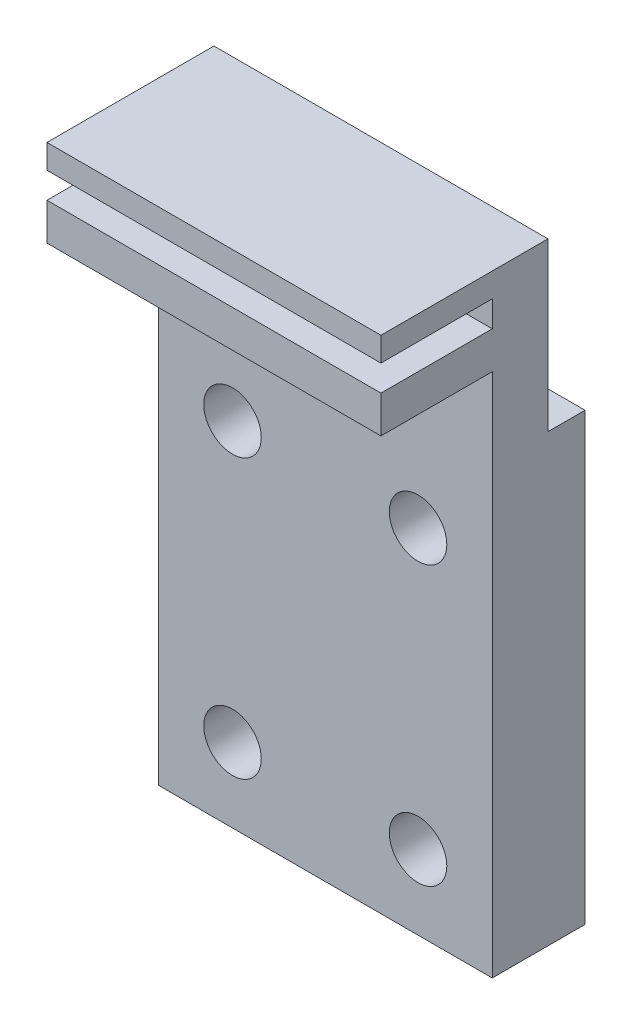
from build123d import *

# Parameters (mm, degrees)
SKIZZE1_W                       = 18
SKIZZE1_H                       = 33
SKIZZE1_R                       = 1.55
AUFSATZ_LINEAR_AUSTRAGEN3_DEPTH = 5
SKIZZE1_4_W                     = 18
SKIZZE1_4_H                     = 2
SKIZZE1_4_H_2                   = 1.3
AUFSATZ_LINEAR_AUSTRAGEN4_DEPTH = 6
SKIZZE2_W                       = 2
SKIZZE2_H                       = 9
SCHNITT_LINEAR_AUSTRAGEN1_DEPTH = 29.674901918


with BuildPart() as part:
    # Skizze1 → Aufsatz-Linear austragen3 (new body)
    with BuildSketch(Plane.XY):
        with Locations((0, 5)):
            Rectangle(SKIZZE1_W, SKIZZE1_H)
        with Locations((5, 7.5)):
            Circle(SKIZZE1_R, mode=Mode.SUBTRACT)
        with Locations((-5, -7.5)):
            Circle(SKIZZE1_R, mode=Mode.SUBTRACT)
        with Locations((5, -7.5)):
            Circle(SKIZZE1_R, mode=Mode.SUBTRACT)
        with Locations((-5, 7.5)):
            Circle(SKIZZE1_R, mode=Mode.SUBTRACT)
    extrude(amount=-AUFSATZ_LINEAR_AUSTRAGEN3_DEPTH)

    # Skizze1<4> → Aufsatz-Linear austragen4 (add)
    with BuildSketch(Plane.XY):
        with Locations((0, 17.8)):
            Rectangle(SKIZZE1_4_W, SKIZZE1_4_H)
        with Locations((0, 20.85)):
            Rectangle(SKIZZE1_4_W, SKIZZE1_4_H_2)
    extrude(amount=AUFSATZ_LINEAR_AUSTRAGEN4_DEPTH)

    # Skizze2 → Schnitt-Linear austragen1 (cut, through all)
    with BuildSketch(Plane(origin=(9, 0, 0), x_dir=(0, 0, -1), z_dir=(1, 0, 0))):
        with Locations((4, 17)):
            Rectangle(SKIZZE2_W, SKIZZE2_H)
    extrude(amount=-SCHNITT_LINEAR_AUSTRAGEN1_DEPTH, mode=Mode.SUBTRACT)


solid = part.part
